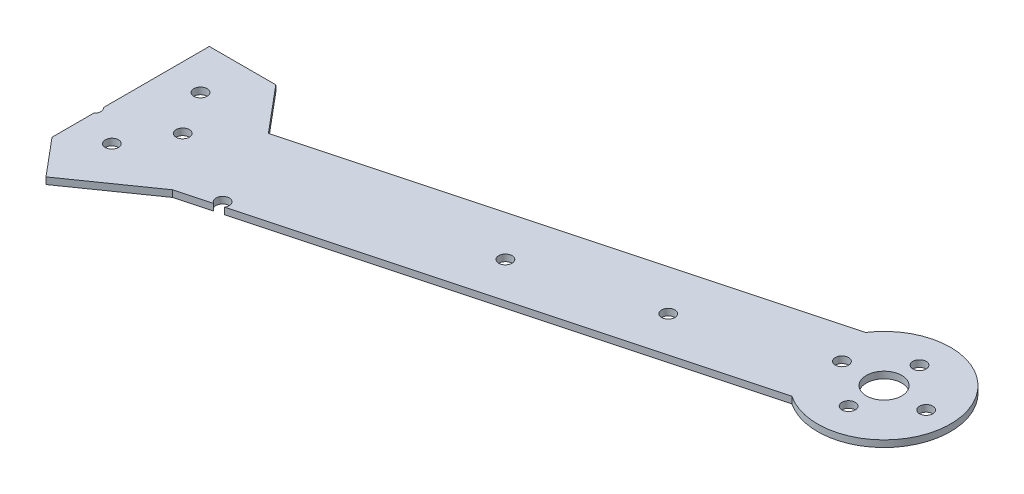
from build123d import *

# Parameters (mm, degrees)
SKETCH2_R           = 4
SKETCH2_R_2         = 1.5
BOSS_EXTRUDE1_DEPTH = 1.5
SKETCH3_R           = 1.5
CUT_EXTRUDE1_DEPTH  = 1.5
SKETCH4_R           = 1.5
CUT_EXTRUDE2_DEPTH  = 1.5


with BuildPart() as part:
    # Sketch2 → Boss-Extrude1 (new body)
    with BuildSketch(Plane(origin=(0, 0, 0), x_dir=(1, 0, 0), z_dir=(0, 1, 0))):
        with BuildLine():
            Line((0, 0), (0, 9.381966011))
            ThreePointArc((0, 9.381966011), (0.5, 10.5), (0, 11.618033989))
            Line((0, 11.618033989), (0, 35.5))
            Line((0, 35.5), (15, 35.5))
            Line((15, 35.5), (23.677632731, 25.158400018))
            Line((23.677632731, 25.158400018), (129.929473623, 53.628494979))
            ThreePointArc((129.929473623, 53.628494979), (157.136079306, 48.289177788), (134.097880355, 32.863579259))
            Line((134.097880355, 32.863579259), (23.863280614, 3.331828071))
            Line((23.863280614, 3.331828071), (7.070663707, -8.426488874))
            Line((7.070663707, -8.426488874), (0, 0))
        make_face()
        with Locations(Location((142.429473623, 45.336933003, 0), (0, 0, 270))):
            Circle(SKETCH2_R, mode=Mode.SUBTRACT)
        with Locations(Location((8, 25.5, 0), (0, 0, 270))):
            Circle(SKETCH2_R_2, mode=Mode.SUBTRACT)
        with Locations(Location((14, 15.5, 0), (0, 0, 270))):
            Circle(SKETCH2_R_2, mode=Mode.SUBTRACT)
        with Locations(Location((8, 5.5, 0), (0, 0, 270))):
            Circle(SKETCH2_R_2, mode=Mode.SUBTRACT)
        with Locations(Location((142.429473623, 53.336933003, 0), (0, 0, 270))):
            Circle(SKETCH2_R_2, mode=Mode.SUBTRACT)
        with Locations(Location((151.929473623, 45.336933003, 0), (0, 0, 270))):
            Circle(SKETCH2_R_2, mode=Mode.SUBTRACT)
        with Locations(Location((142.429473623, 37.336933003, 0), (0, 0, 270))):
            Circle(SKETCH2_R_2, mode=Mode.SUBTRACT)
        with Locations(Location((132.929473623, 45.336933003, 0), (0, 0, 270))):
            Circle(SKETCH2_R_2, mode=Mode.SUBTRACT)
    extrude(amount=BOSS_EXTRUDE1_DEPTH)

    # Sketch3 → Cut-Extrude1 (cut)
    with BuildSketch(Plane(origin=(0, 1.5, 0), x_dir=(1, 0, 0), z_dir=(0, 1, 0))):
        with Locations((31.86, 6.64)):
            Circle(SKETCH3_R)
    extrude(amount=-CUT_EXTRUDE1_DEPTH, mode=Mode.SUBTRACT)

    # Sketch4 → Cut-Extrude2 (cut)
    with BuildSketch(Plane(origin=(0, 1.5, 0), x_dir=(1, 0, 0), z_dir=(0, 1, 0))):
        with Locations(Location((75.037341097, 27.279265517, 0), (0, 0, 270))):
            Circle(SKETCH4_R)
        with Locations(Location((104.015115886, 35.04383687, 0), (0, 0, 270))):
            Circle(SKETCH4_R)
    extrude(amount=-CUT_EXTRUDE2_DEPTH, mode=Mode.SUBTRACT)


solid = part.part
